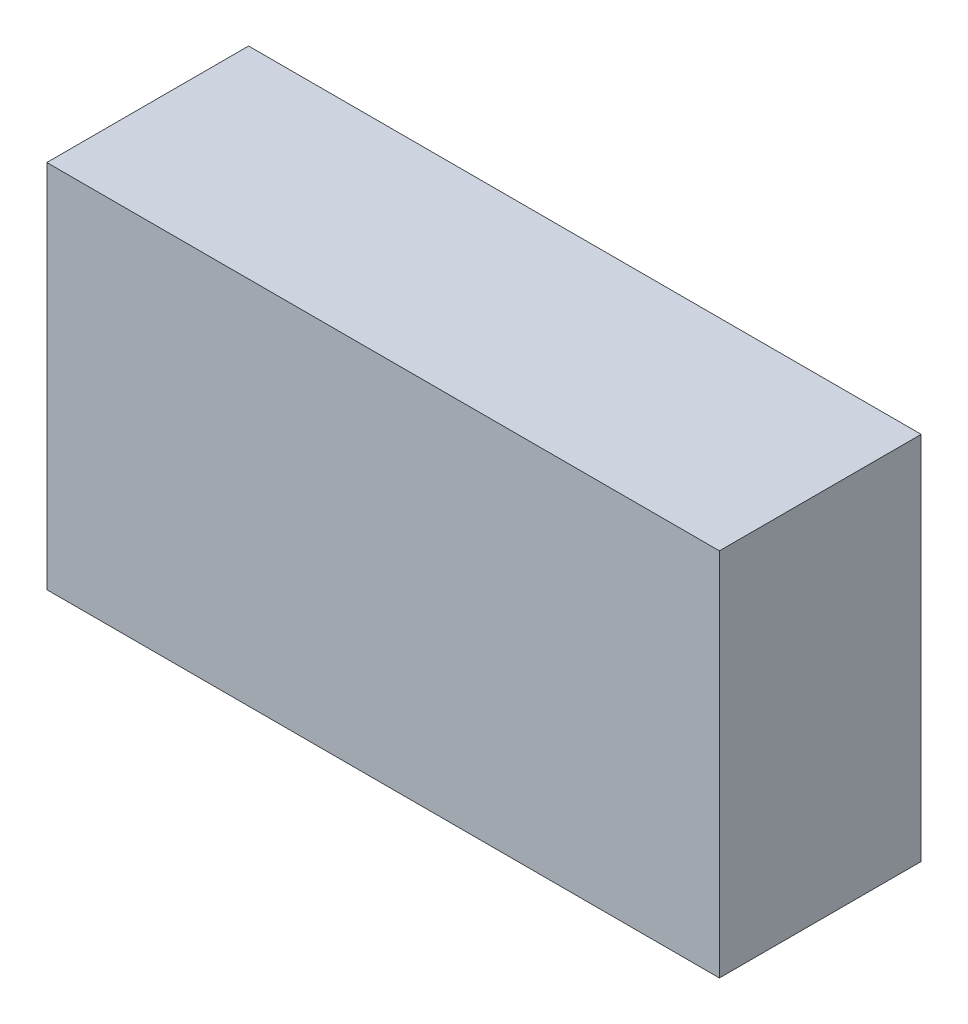
from build123d import *

# Parameters (mm, degrees)
SKETCH_1_W      = 100
SKETCH_1_H      = 55
EXTRUDE_1_DEPTH = 30


with BuildPart() as part:
    # 草图1 → 凸台-拉伸1 (new body)
    with BuildSketch(Plane.XY):
        Rectangle(SKETCH_1_W, SKETCH_1_H)
    extrude(amount=EXTRUDE_1_DEPTH)


solid = part.part
